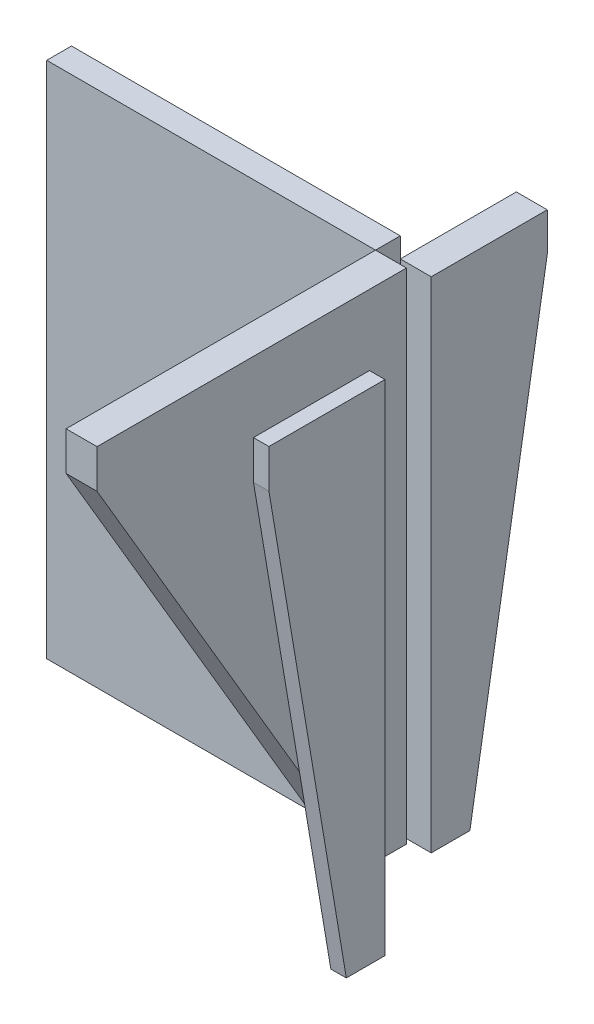
from build123d import *

# Parameters (mm, degrees)
SKETCH1_W             = 425
SKETCH1_H             = 670
BOSS_EXTRUDE1_DEPTH   = 32
BOSS_EXTRUDE2_DEPTH   = 40
BOSS_EXTRUDE2_2_DEPTH = 40
BOSS_EXTRUDE3_DEPTH   = 20


with BuildPart() as part:
    # Sketch1 → Boss-Extrude1 (new body)
    with BuildSketch(Plane.XY):
        with Locations((212.5, -335)):
            Rectangle(SKETCH1_W, SKETCH1_H)
    extrude(amount=BOSS_EXTRUDE1_DEPTH)


with BuildPart() as body_2:
    # Sketch3 → Boss-Extrude2 (new body)
    with BuildSketch(Plane(origin=(425, 0, 0), x_dir=(0, 0, -1), z_dir=(1, 0, 0))):
        Polygon((-32, 0), (-432, 0), (-432, -50), (-82, -645), (-32, -645), align=None)
    extrude(amount=BOSS_EXTRUDE2_DEPTH)

    # Sketch4 → Boss-Extrude3 (add)
    with BuildSketch(Plane(origin=(465, 0, 0), x_dir=(0, 0, -1), z_dir=(1, 0, 0))):
        Polygon((-229.771365321, -90.966417035), (-79.771365321, -90.966417035), (-79.771365321, -735.966417035), (-129.771365321, -735.966417035), (-229.771365321, -140.966417035), align=None)
    extrude(amount=BOSS_EXTRUDE3_DEPTH)


with BuildPart() as body_3:
    # Sketch3 → Boss-Extrude2 2 (new body)
    with BuildSketch(Plane(origin=(425, 0, 0), x_dir=(0, 0, -1), z_dir=(1, 0, 0))):
        Polygon((0, -25.851907968), (150, -25.851907968), (150, -75.851907968), (50, -670.851907968), (0, -670.851907968), align=None)
    extrude(amount=BOSS_EXTRUDE2_2_DEPTH)


solid = Compound([part.part, body_2.part, body_3.part])
